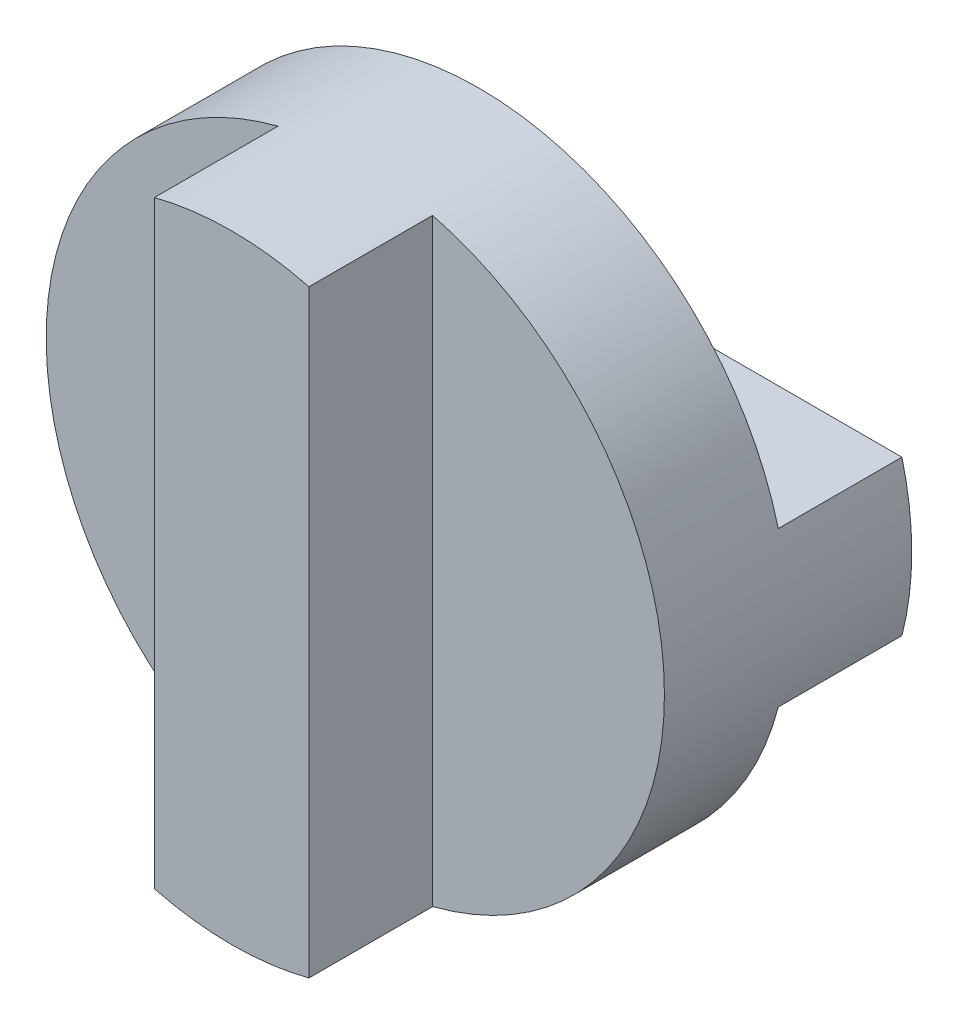
from build123d import *
from build123d.topology import SkipClean

# Parameters (mm, degrees)
SKETCH1_R           = 12.7
BOSS_EXTRUDE1_DEPTH = 5.08
BOSS_EXTRUDE2_START = 5.08
BOSS_EXTRUDE2_DEPTH = 5.08
BOSS_EXTRUDE3_DEPTH = 5.08


with BuildPart() as part:
    # Sketch1 → Boss-Extrude1 (new body)
    with BuildSketch(Plane.XY):
        Circle(SKETCH1_R)
    extrude(amount=BOSS_EXTRUDE1_DEPTH)

    # Sketch2 → Boss-Extrude2 (add)
    with SkipClean():  # the faces are left unmerged after this step: merging them gives an invalid solid
        with BuildSketch(Plane(origin=(0, 0, 0), x_dir=(-1, 0, 0), z_dir=(0, 0, -1)).offset(BOSS_EXTRUDE2_START)):
            with BuildLine():
                Line((12.296722124, 3.175), (-12.296722124, 3.175))
                ThreePointArc((-12.296722124, 3.175), (-12.7, 0), (-12.296722124, -3.175))
                Line((-12.296722124, -3.175), (12.296722124, -3.175))
                ThreePointArc((12.296722124, -3.175), (12.7, 0), (12.296722124, 3.175))
            make_face()
        extrude(amount=-BOSS_EXTRUDE2_DEPTH)

    # Sketch4 → Boss-Extrude3 (add)
    with SkipClean():  # the faces are left unmerged after this step: merging them gives an invalid solid
        with BuildSketch(Plane.XY.offset(5.08)):
            with BuildLine():
                Line((-3.175, -12.296722124), (-3.175, 12.296722124))
                ThreePointArc((-3.175, 12.296722124), (0, 12.7), (3.175, 12.296722124))
                Line((3.175, 12.296722124), (3.175, -12.296722124))
                ThreePointArc((3.175, -12.296722124), (0, -12.7), (-3.175, -12.296722124))
            make_face()
        extrude(amount=BOSS_EXTRUDE3_DEPTH)


solid = part.part
